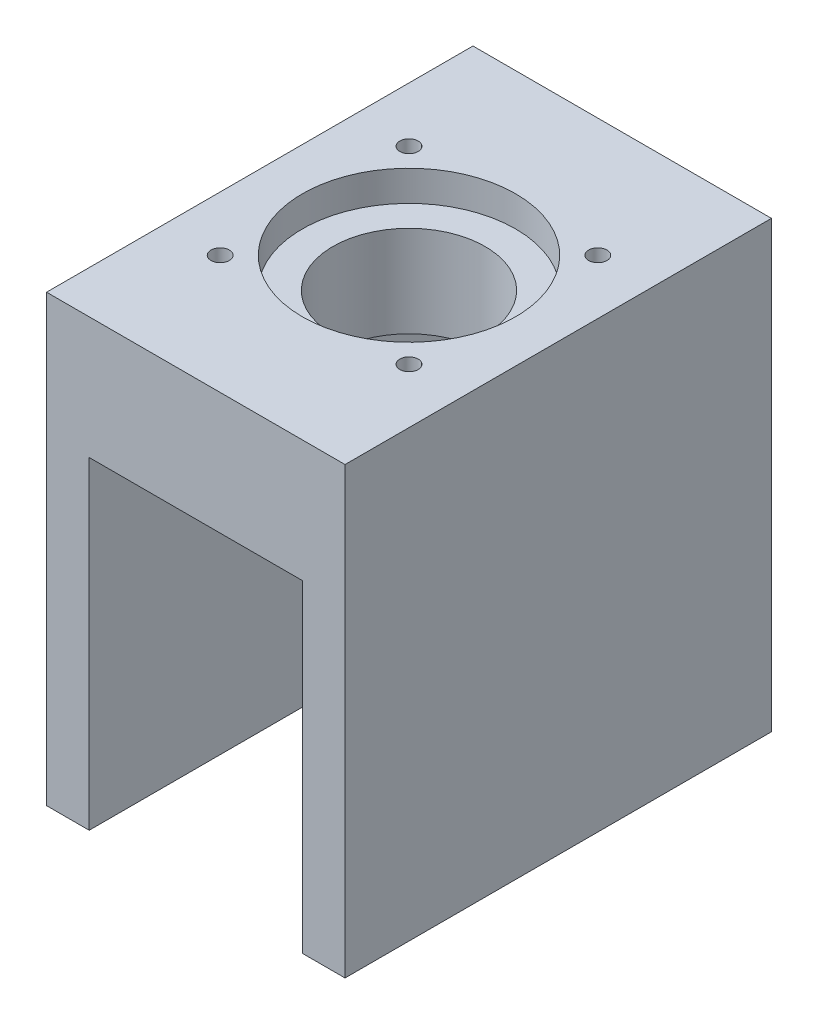
from build123d import *

# Parameters (mm, degrees)
SKETCH1_W           = 49
SKETCH1_H           = 70
BOSS_EXTRUDE1_DEPTH = 20
SKETCH3_R           = 12.5
CUT_EXTRUDE1_DEPTH  = 70
SKETCH4_R           = 1.5
CUT_EXTRUDE2_DEPTH  = 48.172555581
SKETCH5_R           = 17.5
SKETCH5_R_2         = 12.5
CUT_EXTRUDE3_DEPTH  = 5
SKETCH6_W           = 7
SKETCH6_H           = 70
BOSS_EXTRUDE3_DEPTH = 53


with BuildPart() as part:
    # Sketch1 → Boss-Extrude1 (new body)
    with BuildSketch(Plane(origin=(0, 0, 0), x_dir=(1, 0, 0), z_dir=(0, 1, 0))):
        Rectangle(SKETCH1_W, SKETCH1_H)
    extrude(amount=BOSS_EXTRUDE1_DEPTH)

    # Sketch3 → Cut-Extrude1 (cut)
    with BuildSketch(Plane(origin=(0, 20, 0), x_dir=(1, 0, 0), z_dir=(0, 1, 0))):
        with Locations(Location((0, 0, 0), (0, 0, 270))):
            Circle(SKETCH3_R)
    extrude(amount=-CUT_EXTRUDE1_DEPTH, mode=Mode.SUBTRACT)

    # Sketch4 → Cut-Extrude2 (cut, through all)
    with BuildSketch(Plane.XZ):
        with Locations(Location((-15.5, 15.5, 0), (0, 0, 270))):
            Circle(SKETCH4_R)
        with Locations(Location((15.5, 15.5, 0), (0, 0, 270))):
            Circle(SKETCH4_R)
        with Locations(Location((15.5, -15.5, 0), (0, 0, 270))):
            Circle(SKETCH4_R)
        with Locations(Location((-15.5, -15.5, 0), (0, 0, 270))):
            Circle(SKETCH4_R)
    extrude(amount=-CUT_EXTRUDE2_DEPTH, mode=Mode.SUBTRACT)

    # Sketch5 → Cut-Extrude3 (cut)
    with BuildSketch(Plane(origin=(0, 20, 0), x_dir=(1, 0, 0), z_dir=(0, 1, 0))):
        with Locations(Location((0, 0, 0), (0, 0, 270))):
            Circle(SKETCH5_R)
        with Locations(Location((0, 0, 0), (0, 0, 270))):
            Circle(SKETCH5_R_2, mode=Mode.SUBTRACT)
    extrude(amount=-CUT_EXTRUDE3_DEPTH, mode=Mode.SUBTRACT)

    # Sketch6 → Boss-Extrude3 (add)
    with BuildSketch(Plane.XZ):
        with Locations((-21, 0)):
            Rectangle(SKETCH6_W, SKETCH6_H)
        with Locations((21, 0)):
            Rectangle(SKETCH6_W, SKETCH6_H)
    extrude(amount=BOSS_EXTRUDE3_DEPTH)


solid = part.part
